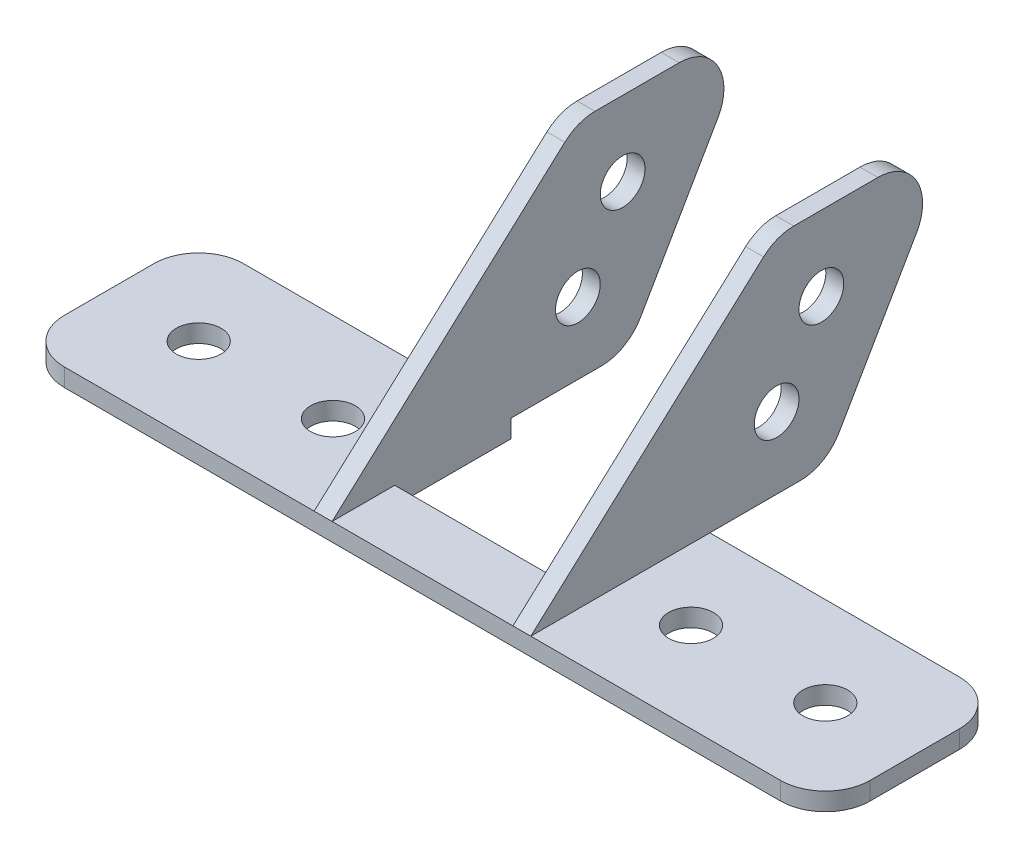
from build123d import *

# Parameters (mm, degrees)
BOSS_EXTRUDE1_DEPTH = 2
SKETCH2_R           = 2.5
CUT_EXTRUDE1_DEPTH  = 47.14108798
BOSS_EXTRUDE2_DEPTH = 2
SKETCH4_R           = 2.5
CUT_EXTRUDE2_DEPTH  = 74.421360263
SKETCH5_R           = 2.5
BOSS_EXTRUDE3_DEPTH = 2
FILLET1_R           = 5
FILLET2_R           = 5


with BuildPart() as part:
    # Sketch1 → Boss-Extrude1 (new body)
    with BuildSketch(Plane(origin=(0, 0, 0), x_dir=(1, 0, 0), z_dir=(0, 1, 0))):
        Polygon((-10.1, 10), (-10.1, 0), (-10.1, -3), (10.1, -3), (10.1, 0), (10.1, 10), (45, 10), (45, -10), (-45, -10), (-45, 10), align=None)
    extrude(amount=BOSS_EXTRUDE1_DEPTH)

    # Sketch2 → Cut-Extrude1 (cut, through all)
    with BuildSketch(Plane(origin=(0, 2, 0), x_dir=(1, 0, 0), z_dir=(0, 1, 0))):
        with Locations(Location((-20, 0, 0), (0, 0, 270))):
            Circle(SKETCH2_R)
        with Locations(Location((-35, 0, 0), (0, 0, 270))):
            Circle(SKETCH2_R)
        with Locations(Location((20, 0, 0), (0, 0, 90))):
            Circle(SKETCH2_R)
        with Locations(Location((35, 0, 0), (0, 0, 90))):
            Circle(SKETCH2_R)
    extrude(amount=-CUT_EXTRUDE1_DEPTH, mode=Mode.SUBTRACT)

    # Sketch3 → Boss-Extrude2 (add)
    with BuildSketch(Plane.ZY.offset(-10.1)):
        Polygon((10, 2), (-17.43375673, 27), (-37.43375673, 27), (-23, 2), align=None)
    extrude(amount=-BOSS_EXTRUDE2_DEPTH)

    # Sketch4 → Cut-Extrude2 (cut, through all)
    with BuildSketch(Plane(origin=(12.1, 0, 0), x_dir=(0, 0, -1), z_dir=(1, 0, 0))):
        with Locations((22.46, 18.65)):
            Circle(SKETCH4_R)
        with Locations((17.46, 9.99)):
            Circle(SKETCH4_R)
    extrude(amount=-CUT_EXTRUDE2_DEPTH, mode=Mode.SUBTRACT)

    # Sketch5 → Boss-Extrude3 (add)
    with BuildSketch(Plane(origin=(-10.1, 0, 0), x_dir=(0, 0, -1), z_dir=(1, 0, 0))):
        Polygon((-10, 2), (17.43375673, 27), (37.43375673, 27), (23, 2), align=None)
        with Locations((22.46, 18.65)):
            Circle(SKETCH5_R, mode=Mode.SUBTRACT)
        with Locations((17.46, 9.99)):
            Circle(SKETCH5_R, mode=Mode.SUBTRACT)
    extrude(amount=-BOSS_EXTRUDE3_DEPTH)

    # Fillet1
    fillet1_edges = [part.edges().sort_by_distance(p)[0] for p in [
        (11.1, 2, -23),
        (11.1, 27, -37.43375673),
        (11.1, 27, -17.43375673),
        (-11.1, 2, -23),
        (-11.1, 27, -17.43375673),
        (-11.1, 27, -37.43375673),
    ]]
    fillet(fillet1_edges, radius=FILLET1_R)

    # Fillet2
    fillet2_edges = [part.edges().sort_by_distance(p)[0] for p in [
        (45, 1, 10),
        (-45, 1, 10),
        (-45, 1, -10),
        (45, 1, -10),
    ]]
    fillet(fillet2_edges, radius=FILLET2_R)


solid = part.part
